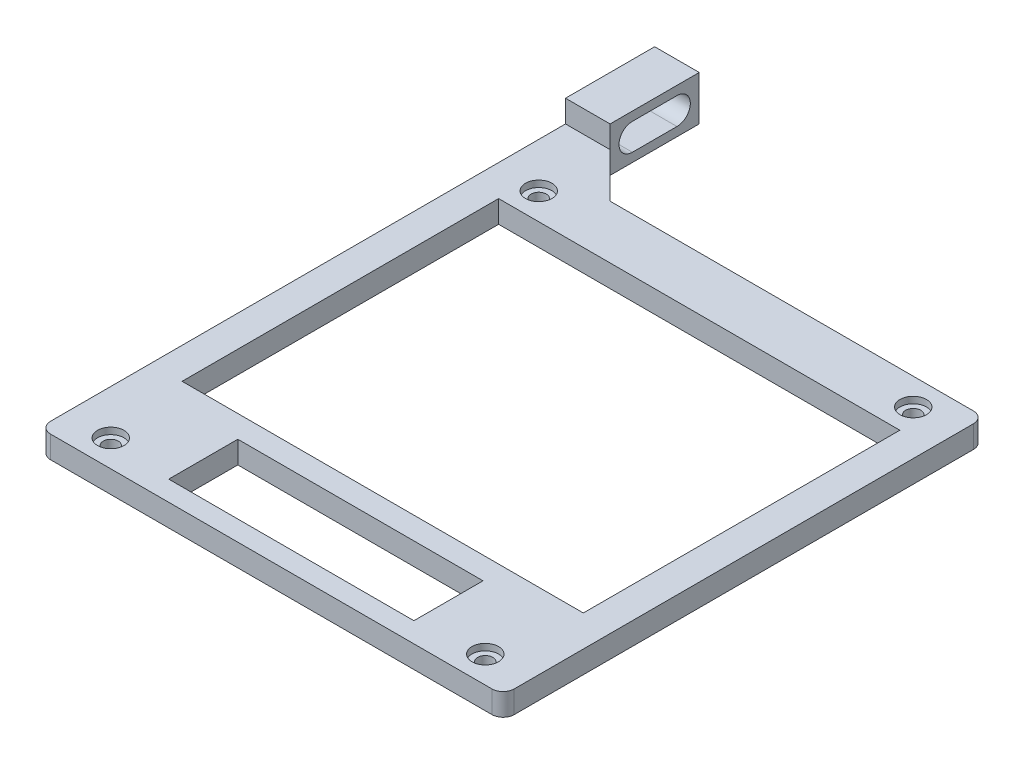
from build123d import *

# Parameters (mm, degrees)
SKETCH1_W                                      = 132.08
SKETCH1_H                                      = 137.16
BOSS_EXTRUDE1_DEPTH                            = 6.35
CBORE_FOR_6_BUTTON_HEAD_CAP_SCREW1_D           = 4.3053
CBORE_FOR_6_BUTTON_HEAD_CAP_SCREW1_CBORE_D     = 7.54126
CBORE_FOR_6_BUTTON_HEAD_CAP_SCREW1_CBORE_DEPTH = 1.8542
SKETCH5_W                                      = 114.3
SKETCH5_H                                      = 106.68
CUT_EXTRUDE1_DEPTH                             = 191.521165491
SKETCH6_W                                      = 12.7
SKETCH6_H                                      = 38.1
BOSS_EXTRUDE2_DEPTH                            = 6.35
SKETCH7_W                                      = 12.7
SKETCH7_H                                      = 6.35
BOSS_EXTRUDE3_DEPTH                            = 25.4
CUT_EXTRUDE2_REACH                             = 221.824
CHAMFER1_SIZE                                  = 12.7
CUT_EXTRUDE3_REACH                             = 221.548
SKETCH9_W                                      = 69.85
SKETCH9_H                                      = 9.525
FILLET1_R                                      = 3.175
BOSS_EXTRUDE4_DEPTH                            = 6.35


with BuildPart() as part:
    # Sketch1 → Boss-Extrude1 (new body)
    with BuildSketch(Plane(origin=(0, 0, 0), x_dir=(1, 0, 0), z_dir=(0, 1, 0))):
        with Locations((66.04, 68.58)):
            Rectangle(SKETCH1_W, SKETCH1_H)
    extrude(amount=BOSS_EXTRUDE1_DEPTH)

    # CBORE for #6 Button Head Cap Screw1 (through all)
    with Locations(Plane(origin=(0, 6.35, 0), x_dir=(1, 0, 0), z_dir=(0, 1, 0))):
        with Locations((12.7, 129.54), (119.38, 129.54), (119.38, 7.62), (12.7, 7.62)):
            CounterBoreHole(CBORE_FOR_6_BUTTON_HEAD_CAP_SCREW1_D / 2, CBORE_FOR_6_BUTTON_HEAD_CAP_SCREW1_CBORE_D / 2, CBORE_FOR_6_BUTTON_HEAD_CAP_SCREW1_CBORE_DEPTH)

    # Sketch5 → Cut-Extrude1 (cut, through all)
    with BuildSketch(Plane(origin=(0, 6.35, 0), x_dir=(1, 0, 0), z_dir=(0, 1, 0))):
        with Locations((66.04, 68.58)):
            Rectangle(SKETCH5_W, SKETCH5_H)
    extrude(amount=-CUT_EXTRUDE1_DEPTH, mode=Mode.SUBTRACT)

    # Sketch6 → Boss-Extrude2 (add)
    with BuildSketch(Plane(origin=(0, 0, 0), x_dir=(-1, 0, 0), z_dir=(0, -1, 0))):
        with Locations((-6.35, 156.21)):
            Rectangle(SKETCH6_W, SKETCH6_H)
    extrude(amount=-BOSS_EXTRUDE2_DEPTH)

    # Sketch7 → Boss-Extrude3 (add)
    with BuildSketch(Plane(origin=(0, 0, -175.26), x_dir=(-1, 0, 0), z_dir=(0, 0, -1))):
        with Locations((-6.35, 9.525)):
            Rectangle(SKETCH7_W, SKETCH7_H)
    extrude(amount=-BOSS_EXTRUDE3_DEPTH)

    # Sketch8 → Cut-Extrude2 (cut, up to next)
    with BuildSketch(Plane.ZY, mode=Mode.PRIVATE) as cut_extrude2_sk1:
        with BuildLine():
            Line((-152.4, 6.35), (-172.72, 6.35))
            ThreePointArc((-172.72, 6.35), (-171.604076836, 3.655923164), (-168.91, 2.54))
            Line((-168.91, 2.54), (-156.21, 2.54))
            ThreePointArc((-156.21, 2.54), (-153.515923164, 3.655923164), (-152.4, 6.35))
        make_face()
    cut_extrude2_tool1 = extrude(cut_extrude2_sk1.sketch, amount=-CUT_EXTRUDE2_REACH, mode=Mode.PRIVATE) & part.part
    # Sketch8 → Cut-Extrude2 (cut, up to next)
    with BuildSketch(Plane.ZY, mode=Mode.PRIVATE) as cut_extrude2_sk2:
        with BuildLine():
            ThreePointArc((-168.91, 10.16), (-171.604076836, 9.044076836), (-172.72, 6.35))
            Line((-172.72, 6.35), (-152.4, 6.35))
            ThreePointArc((-152.4, 6.35), (-153.515923164, 9.044076836), (-156.21, 10.16))
            Line((-156.21, 10.16), (-168.91, 10.16))
        make_face()
    cut_extrude2_tool2 = extrude(cut_extrude2_sk2.sketch, amount=-CUT_EXTRUDE2_REACH, mode=Mode.PRIVATE) & part.part
    add(cut_extrude2_tool1.solids().sort_by_distance((0, 4.537242, -162.56))[0], mode=Mode.SUBTRACT)
    add(cut_extrude2_tool2.solids().sort_by_distance((0, 8.162758, -162.56))[0], mode=Mode.SUBTRACT)

    # Chamfer1
    chamfer1_edges = [part.edges().sort_by_distance(p)[0] for p in [
        (12.7, 3.175, -137.16),
    ]]
    chamfer(chamfer1_edges, length=CHAMFER1_SIZE)

    # Sketch9 → Cut-Extrude3 (cut, up to next)
    with BuildSketch(Plane(origin=(0, 6.35, 0), x_dir=(1, 0, 0), z_dir=(0, 1, 0)), mode=Mode.PRIVATE) as cut_extrude3_sk1:
        with Locations((66.04, 10.4775)):
            Rectangle(SKETCH9_W, SKETCH9_H)
    cut_extrude3_tool1 = extrude(cut_extrude3_sk1.sketch, amount=-CUT_EXTRUDE3_REACH, mode=Mode.PRIVATE) & part.part
    add(cut_extrude3_tool1.solids().sort_by_distance((66.04, 6.35, -10.4775))[0], mode=Mode.SUBTRACT)

    # Fillet1
    fillet1_edges = [part.edges().sort_by_distance(p)[0] for p in [
        (132.08, 3.175, -137.16),
        (132.08, 3.175, 0),
        (0, 3.175, 0),
    ]]
    fillet(fillet1_edges, radius=FILLET1_R)

    # Sketch11 → Boss-Extrude4 (add)
    with BuildSketch(Plane(origin=(0, 6.35, 0), x_dir=(1, 0, 0), z_dir=(0, 1, 0))):
        Polygon((8.89, 15.24), (31.115, 15.24), (31.115, 25.4), (100.965, 25.4), (100.965, 15.24), (123.19, 15.24), (123.19, 31.75), (8.89, 31.75), align=None)
    extrude(amount=-BOSS_EXTRUDE4_DEPTH)


solid = part.part
